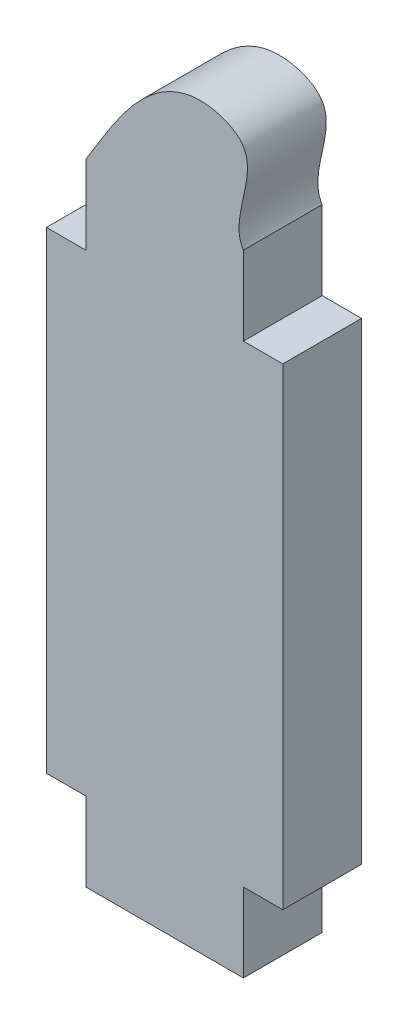
from build123d import *

# Parameters (mm, degrees)
SKETCH1_W           = 9.525
SKETCH1_H           = 19.05
SKETCH1_W_2         = 6.35
SKETCH1_H_2         = 3.175
BOSS_EXTRUDE1_DEPTH = 3.175


with BuildPart() as part:
    # Sketch1 → Boss-Extrude1 (new body)
    with BuildSketch(Plane.XY):
        Rectangle(SKETCH1_W, SKETCH1_H)
        with Locations((0, 11.1125)):
            Rectangle(SKETCH1_W_2, SKETCH1_H_2)
        with BuildLine():
            add(Edge.make_bspline(
                [(-3.175, 12.7), (-2.213811761, 14.173592311), (-0.385937212, 17.971687726), (4.31508926, 16.239746311), (2.576510016, 13.616240346), (3.175, 12.7)],
                knots=[0, 0, 0, 0, 0.552544755, 0.69848067, 1, 1, 1, 1], degree=3))
            Line((3.175, 12.7), (-3.175, 12.7))
        make_face()
        with Locations((0, -11.1125)):
            Rectangle(SKETCH1_W_2, SKETCH1_H_2)
    extrude(amount=BOSS_EXTRUDE1_DEPTH)


solid = part.part
